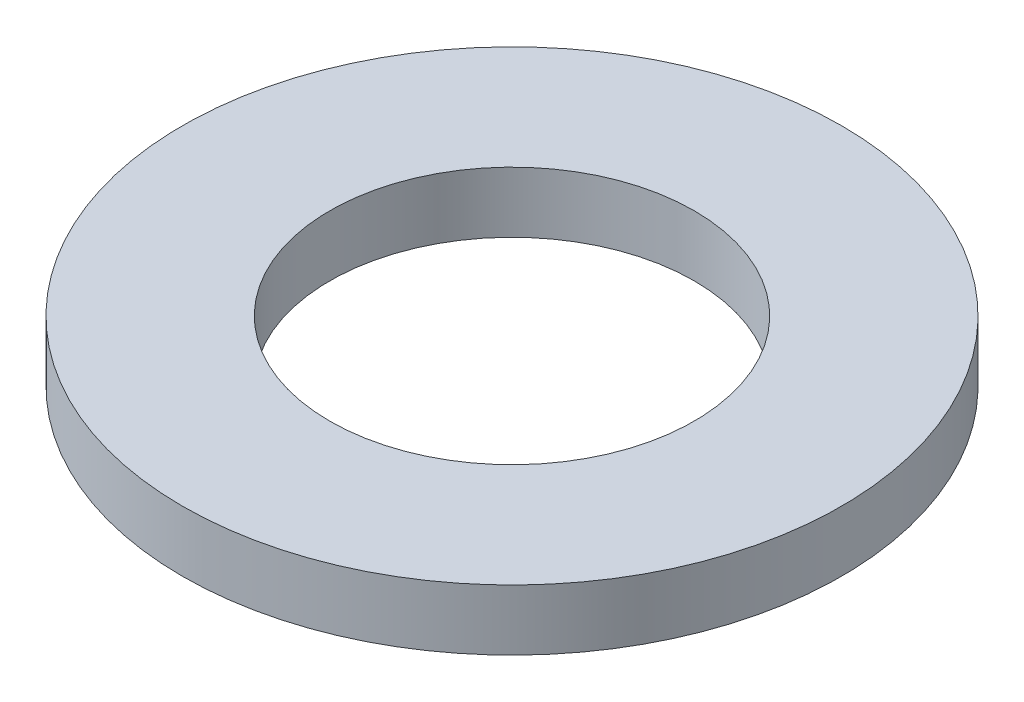
from build123d import *

# Parameters (mm, degrees)
SKETCH1_R           = 2.7559
SKETCH1_R_2         = 1.524
BOSS_EXTRUDE1_DEPTH = 0.508


with BuildPart() as part:
    # Sketch1 → Boss-Extrude1 (new body)
    with BuildSketch(Plane(origin=(0, 0, 0), x_dir=(1, 0, 0), z_dir=(0, 1, 0))):
        with Locations(Location((-13.49029492, 17.546817169, 0), (0, 0, 270))):
            Circle(SKETCH1_R)
        with Locations(Location((-13.49029492, 17.546817169, 0), (0, 0, 270))):
            Circle(SKETCH1_R_2, mode=Mode.SUBTRACT)
    extrude(amount=BOSS_EXTRUDE1_DEPTH)


solid = part.part
